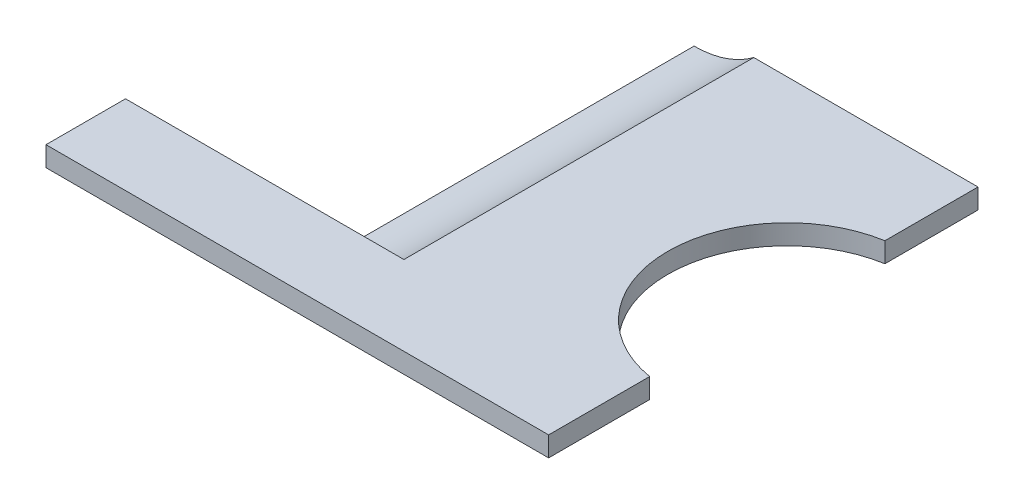
from build123d import *

# Parameters (mm, degrees)
SKETCH_1_W          = 12.642384092
SKETCH_1_H          = 0.502134845
EXTRUDE_1_DEPTH     = 2
EXTRUDE_2_DEPTH     = 10.8
SKETCH_4_R          = 3
CUT_EXTRUDE_2_DEPTH = 10


with BuildPart() as part:
    # 스케치1 → 보스-돌출1 (new body)
    with BuildSketch(Plane.XY):
        with Locations((0.821192046, -2.248932578)):
            Rectangle(SKETCH_1_W, SKETCH_1_H)
    extrude(amount=EXTRUDE_1_DEPTH)

    # 스케치2 → 보스-돌출2 (add)
    with BuildSketch(Plane.XY.offset(2)):
        with BuildLine():
            Line((1.502842247, -1.997865155), (7.142384092, -1.997865155))
            Line((7.142384092, -1.997865155), (7.142384092, -2.5))
            Line((7.142384092, -2.5), (0, -2.5))
            ThreePointArc((0, -2.5), (0.79225536, -2.371145597), (1.502842247, -1.997865155))
        make_face()
    extrude(amount=-EXTRUDE_2_DEPTH)

    # 스케치4 → 컷-돌출2 (cut)
    with BuildSketch(Plane.XZ.offset(2.5)):
        with Locations((7.642384092, -3.5)):
            Circle(SKETCH_4_R)
    extrude(amount=-CUT_EXTRUDE_2_DEPTH, mode=Mode.SUBTRACT)


solid = part.part
